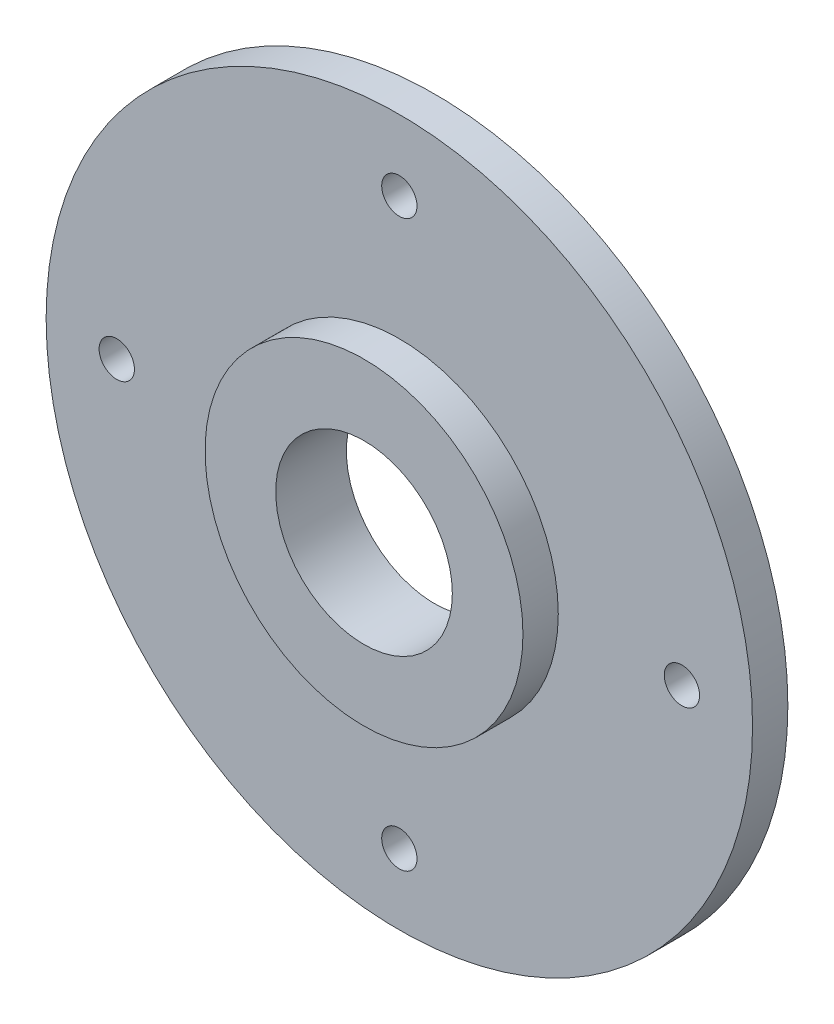
from build123d import *

# Parameters (mm, degrees)
SKETCH_1_R          = 10
EXTRUDE_1_DEPTH     = 1
SKETCH_2_R          = 4.5
EXTRUDE_2_DEPTH     = 1
SKETCH_3_R          = 2.5
CUT_EXTRUDE_1_DEPTH = 15.282856857
SKETCH_4_R          = 0.5
CUT_EXTRUDE_2_DEPTH = 15.282856857


with BuildPart() as part:
    # 草图1 → 凸台-拉伸1 (new body)
    with BuildSketch(Plane.XY):
        Circle(SKETCH_1_R)
    extrude(amount=EXTRUDE_1_DEPTH)

    # 草图2 → 凸台-拉伸2 (add)
    with BuildSketch(Plane.XY.offset(1)):
        Circle(SKETCH_2_R)
    extrude(amount=EXTRUDE_2_DEPTH)

    # 草图3 → 切除-拉伸1 (cut, through all)
    with BuildSketch(Plane.XY.offset(2)):
        Circle(SKETCH_3_R)
    extrude(amount=-CUT_EXTRUDE_1_DEPTH, mode=Mode.SUBTRACT)

    # 草图4 → 切除-拉伸2 (cut, through all)
    with BuildSketch(Plane(origin=(0, 0, 0), x_dir=(-1, 0, 0), z_dir=(0, 0, -1))):
        with Locations((0, 8)):
            Circle(SKETCH_4_R)
        with Locations((8, 0)):
            Circle(SKETCH_4_R)
        with Locations((0, -8)):
            Circle(SKETCH_4_R)
        with Locations((-8, 0)):
            Circle(SKETCH_4_R)
    extrude(amount=-CUT_EXTRUDE_2_DEPTH, mode=Mode.SUBTRACT)


solid = part.part
